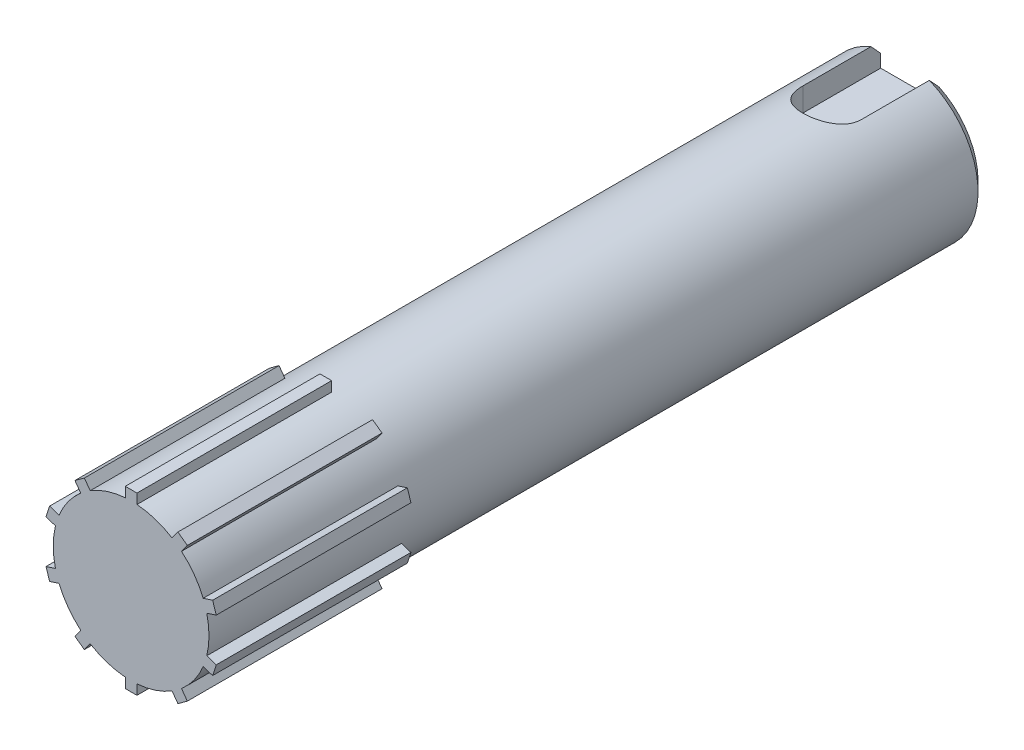
from build123d import *

# Parameters (mm, degrees)
SKETCH1_R           = 4
BOSS_EXTRUDE1_DEPTH = 40
CUT_EXTRUDE1_START  = 2.5
CUT_EXTRUDE1_DEPTH  = 38.898019753
CHAMFER1_SIZE       = 0.5
SKETCH3_W           = 0.6
SKETCH3_H           = 1
BOSS_EXTRUDE2_DEPTH = 10
CIRPATTERN1_COUNT   = 10


with BuildPart() as part:
    # Sketch1 → Boss-Extrude1 (new body)
    with BuildSketch(Plane.XY):
        Circle(SKETCH1_R)
    extrude(amount=BOSS_EXTRUDE1_DEPTH)

    # Sketch2 → Cut-Extrude1 (cut, through all)
    with BuildSketch(Plane(origin=(0, 0, 0), x_dir=(1, 0, 0), z_dir=(0, 1, 0)).offset(CUT_EXTRUDE1_START)):
        with BuildLine():
            Line((1.5, 0), (1.5, -4))
            ThreePointArc((1.5, -4), (0, -5.5), (-1.5, -4))
            Line((-1.5, -4), (-1.5, 0))
            ThreePointArc((-1.5, 0), (0, 1.5), (1.5, 0))
        make_face()
    extrude(amount=CUT_EXTRUDE1_DEPTH, mode=Mode.SUBTRACT)

    # Chamfer1
    chamfer1_edges = [part.edges().sort_by_distance(p)[0] for p in [
        (-2.236067977, -3.31662479, 0),
    ]]
    chamfer(chamfer1_edges, length=CHAMFER1_SIZE)

    # Sketch3 → Boss-Extrude2 (add)
    with BuildSketch(Plane.XY.offset(40)):
        with Locations((0, 4)):
            Rectangle(SKETCH3_W, SKETCH3_H)
    boss_extrude2 = extrude(amount=-BOSS_EXTRUDE2_DEPTH)

    # CirPattern1: Boss-Extrude2 ×10 about axis
    cirpattern1_axis = Axis((0, 0, 0), (0, 0, 1))
    for i in range(1, CIRPATTERN1_COUNT):
        add(boss_extrude2.rotate(cirpattern1_axis, i * 360 / CIRPATTERN1_COUNT))


solid = part.part
